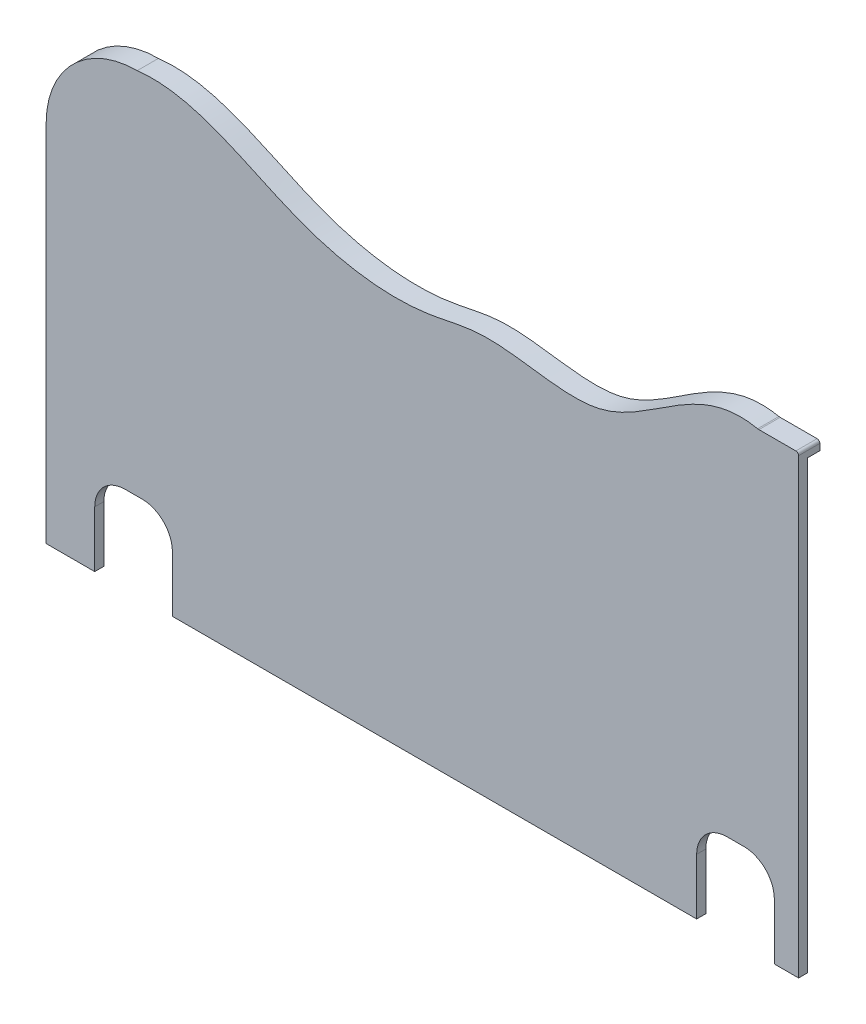
from build123d import *

# Parameters (mm, degrees)
BOSS_EXTRUDE1_DEPTH = 3
BOSS_EXTRUDE2_DEPTH = 3
BOSS_EXTRUDE5_START = 4
BOSS_EXTRUDE5_DEPTH = 4


with BuildPart() as part:
    # Sketch1 → Boss-Extrude1 (new body)
    with BuildSketch(Plane.XY):
        with BuildLine():
            Line((-124.765521303, -62.420756715), (-108.765521303, -62.420756715))
            Line((-108.765521303, -62.420756715), (-108.761709468, -43.920757107))
            ThreePointArc((-108.761709468, -43.920757107), (-105.835782296, -36.843166813), (-98.760678208, -33.911232925))
            Line((-98.760678208, -33.911232925), (-93.160679046, -33.908168006))
            ThreePointArc((-93.160679046, -33.908168006), (-86.099239047, -36.828472645), (-83.161701095, -43.882761045))
            Line((-83.161701095, -43.882761045), (-83.165512931, -62.382760652))
            Line((-83.165512931, -62.382760652), (89.634487069, -62.382760652))
            Line((89.634487069, -62.382760652), (89.639059879, -43.900228298))
            ThreePointArc((89.639059879, -43.900228298), (92.569741149, -36.829885233), (99.641533275, -33.902702306))
            Line((99.641533275, -33.902702306), (105.241533104, -33.904087579))
            ThreePointArc((105.241533104, -33.904087579), (112.311876169, -36.834768849), (115.239059096, -43.906560975))
            Line((115.239059096, -43.906560975), (115.234478942, -62.418777415))
            Line((115.234478942, -62.418777415), (123.234478697, -62.420756715))
            Line((123.234478697, -62.420756715), (123.234478697, 86.679243285))
            ThreePointArc((123.234478697, 86.679243285), (122.9708748, 87.315639388), (122.334478697, 87.579243285))
            Line((122.334478697, 87.579243285), (110.157919421, 87.579243285))
            ThreePointArc((110.157919421, 87.579243285), (109.9524496, 87.589825744), (109.749154155, 87.621461133))
            add(Edge.make_bspline(
                [(-94.765521303, 87.579243285), (-74.957455301, 89.940177419), (-46.2376476, 68.954253783), (-6.60073203, 63.299190552), (25.004355226, 72.030705776), (58.016388628, 59.38666161), (84.058797825, 84.553468887), (102.329172258, 89.170678891), (109.749154155, 87.621461133)],
                knots=[0, 0, 0, 0, 0.273591438, 0.468641213, 0.542501715, 0.732723471, 0.90422006, 0.999913238, 0.999913238, 0.999913238, 0.999913238], degree=3))
            ThreePointArc((-94.765521303, 87.579243285), (-115.978724739, 78.792446721), (-124.765521303, 57.579243285))
            Line((-124.765521303, 57.579243285), (-124.765521303, -62.420756715))
        make_face()
    extrude(amount=BOSS_EXTRUDE1_DEPTH)

    # Sketch2 → Boss-Extrude2 (add)
    with BuildSketch(Plane(origin=(0, 0, 0), x_dir=(-1, 0, 0), z_dir=(0, 0, -1))):
        with BuildLine():
            Line((65.765521304, 44.617239348), (71.765521304, 44.617239348))
            ThreePointArc((71.765521304, 44.617239348), (72.472628085, 44.324346129), (72.765521304, 43.617239348))
            Line((72.765521304, 43.617239348), (72.765521304, 39.617239348))
            ThreePointArc((72.765521304, 39.617239348), (72.472628085, 38.910132567), (71.765521304, 38.617239348))
            Line((71.765521304, 38.617239348), (65.765521304, 38.617239348))
            ThreePointArc((65.765521304, 38.617239348), (65.058414523, 38.910132567), (64.765521304, 39.617239348))
            Line((64.765521304, 39.617239348), (64.765521304, 43.617239348))
            ThreePointArc((64.765521304, 43.617239348), (65.058414523, 44.324346129), (65.765521304, 44.617239348))
        make_face()
        with BuildLine():
            Line((-79.234478696, 43.617239348), (-79.234478696, 39.617239348))
            ThreePointArc((-79.234478696, 39.617239348), (-78.941585477, 38.910132567), (-78.234478696, 38.617239348))
            Line((-78.234478696, 38.617239348), (-72.234478696, 38.617239348))
            ThreePointArc((-72.234478696, 38.617239348), (-71.527371915, 38.910132567), (-71.234478696, 39.617239348))
            Line((-71.234478696, 39.617239348), (-71.234478696, 43.617239348))
            ThreePointArc((-71.234478696, 43.617239348), (-71.527371915, 44.324346129), (-72.234478696, 44.617239348))
            Line((-72.234478696, 44.617239348), (-78.234478696, 44.617239348))
            ThreePointArc((-78.234478696, 44.617239348), (-78.941585477, 44.324346129), (-79.234478696, 43.617239348))
        make_face()
    extrude(amount=BOSS_EXTRUDE2_DEPTH)

    # Sketch3 → Boss-Extrude5 (add)
    with BuildSketch(Plane(origin=(0, 0, 0), x_dir=(-1, 0, 0), z_dir=(0, 0, -1)).offset(BOSS_EXTRUDE5_START)):
        with BuildLine():
            Line((-110.157919421, 84.579243285), (-120.234478697, 84.579243285))
            Line((-120.234478697, 84.579243285), (-123.234478697, 84.579243285))
            Line((-123.234478697, 84.579243285), (-123.234478697, 86.679243285))
            ThreePointArc((-123.234478697, 86.679243285), (-122.9708748, 87.315639388), (-122.334478697, 87.579243285))
            Line((-122.334478697, 87.579243285), (-110.157919421, 87.579243285))
            ThreePointArc((-110.157919421, 87.579243285), (-109.9524496, 87.589825744), (-109.749154155, 87.621461133))
            add(Edge.make_bspline(
                [(94.765521303, 87.579243285), (74.957455301, 89.940177419), (46.2376476, 68.954253783), (6.60073203, 63.299190552), (-25.004355226, 72.030705776), (-58.016388628, 59.38666161), (-84.058797825, 84.553468887), (-102.329172258, 89.170678891), (-109.749154155, 87.621461133)],
                knots=[0, 0, 0, 0, 0.273591438, 0.468641213, 0.542501715, 0.732723471, 0.90422006, 0.999913238, 0.999913238, 0.999913238, 0.999913238], degree=3))
            ThreePointArc((94.765521303, 87.579243285), (115.978724739, 78.792446721), (124.765521303, 57.579243285))
            Line((124.765521303, 57.579243285), (124.765521303, -62.420756715))
            Line((124.765521303, -62.420756715), (121.765521303, -62.420756715))
            Line((121.765521303, -62.420756715), (121.765521303, -59.420756715))
            Line((121.765521303, -59.420756715), (121.765521303, 57.579243285))
            ThreePointArc((121.765521303, 57.579243285), (113.795971322, 76.732362407), (94.59204189, 84.578685963))
            add(Edge.make_bspline(
                [(94.59204189, 84.578685963), (94.027334184, 84.64599378), (93.463219473, 84.705649858), (92.33724846, 84.795820483), (91.77521646, 84.828602168), (90.091898927, 84.891095083), (88.973394431, 84.884921011), (85.628249078, 84.732612919), (83.412006817, 84.452299932), (80.104755866, 83.811018944), (79.004932212, 83.560498553), (76.81129283, 82.995255315), (75.726580156, 82.682972493), (72.502043825, 81.673602297), (70.391652345, 80.904408494), (64.132156627, 78.421220067), (60.053549302, 76.534513761), (53.92897583, 73.720776846), (51.886718133, 72.784660837), (47.778947181, 70.969403035), (45.712268016, 70.0898512), (41.552372793, 68.445936347), (39.45707394, 67.683836563), (35.228985166, 66.305822351), (33.09695122, 65.686960226), (26.644351427, 64.050670969), (22.267885847, 63.251208359), (16.687800606, 62.678855788), (15.56383119, 62.585786287), (13.316785567, 62.445817879), (12.195290199, 62.398906989), (8.836993911, 62.328617547), (6.606372824, 62.375568599), (2.162421001, 62.666243548), (-0.050907189, 62.909996442), (-4.459148919, 63.607070175), (-6.654100587, 64.059957097), (-11.046425878, 64.938167897), (-13.245132, 65.362789293), (-16.538268215, 65.77297774), (-17.635353088, 65.868973619), (-19.828079765, 65.967244496), (-20.923786317, 65.973724718), (-24.209426682, 65.89709212), (-26.39789394, 65.718733271), (-30.773067437, 65.247645537), (-32.959763596, 64.954261923), (-37.333234472, 64.372596755), (-39.519858855, 64.083857412), (-43.898365974, 63.627871621), (-46.090160722, 63.460155549), (-49.38572835, 63.395387974), (-50.485568825, 63.405060058), (-52.137888511, 63.480266867), (-52.689088889, 63.515467765), (-53.792450439, 63.608659511), (-54.345911147, 63.666824331), (-55.998354384, 63.878302139), (-57.083809169, 64.067722381), (-59.2187587, 64.554249363), (-60.268195866, 64.851528536), (-63.370586667, 65.880880898), (-65.377672236, 66.750311325), (-68.327608131, 68.236207558), (-69.301343918, 68.76226389), (-71.220369253, 69.851967823), (-72.167683568, 70.4165874), (-76.864268772, 73.304483807), (-80.493101442, 75.822932572), (-85.182631647, 78.722261709), (-86.128348858, 79.289469419), (-88.044651029, 80.383586278), (-89.01455999, 80.910026033), (-91.960518496, 82.3952214), (-93.975984432, 83.263721559), (-97.130652753, 84.255935405), (-98.208454188, 84.534590379), (-100.366809822, 84.953643768), (-101.452349087, 85.09598358), (-103.63727797, 85.234381715), (-104.736668827, 85.230426953), (-106.950020265, 85.068638259), (-108.048805247, 84.911784564), (-109.136006255, 84.684787904)],
                knots=[0, 0, 0, 0, 0.0078125, 0.0078125, 0.015625, 0.015625, 0.03125, 0.03125, 0.0625, 0.0625, 0.078125, 0.078125, 0.09375, 0.09375, 0.125, 0.125, 0.1875, 0.1875, 0.21875, 0.21875, 0.25, 0.25, 0.28125, 0.28125, 0.3125, 0.3125, 0.375, 0.375, 0.390625, 0.390625, 0.40625, 0.40625, 0.4375, 0.4375, 0.46875, 0.46875, 0.5, 0.5, 0.53125, 0.53125, 0.546875, 0.546875, 0.5625, 0.5625, 0.59375, 0.59375, 0.625, 0.625, 0.65625, 0.65625, 0.6875, 0.6875, 0.703125, 0.703125, 0.7109375, 0.7109375, 0.71875, 0.71875, 0.734375, 0.734375, 0.75, 0.75, 0.78125, 0.78125, 0.796875, 0.796875, 0.8125, 0.8125, 0.875, 0.875, 0.890625, 0.890625, 0.90625, 0.90625, 0.9375, 0.9375, 0.953125, 0.953125, 0.96875, 0.96875, 0.984375, 0.984375, 1, 1, 1, 1], degree=3))
            ThreePointArc((-109.136006255, 84.684787904), (-109.644244868, 84.605699433), (-110.157919421, 84.579243285))
        make_face()
    extrude(amount=-BOSS_EXTRUDE5_DEPTH)


solid = part.part
